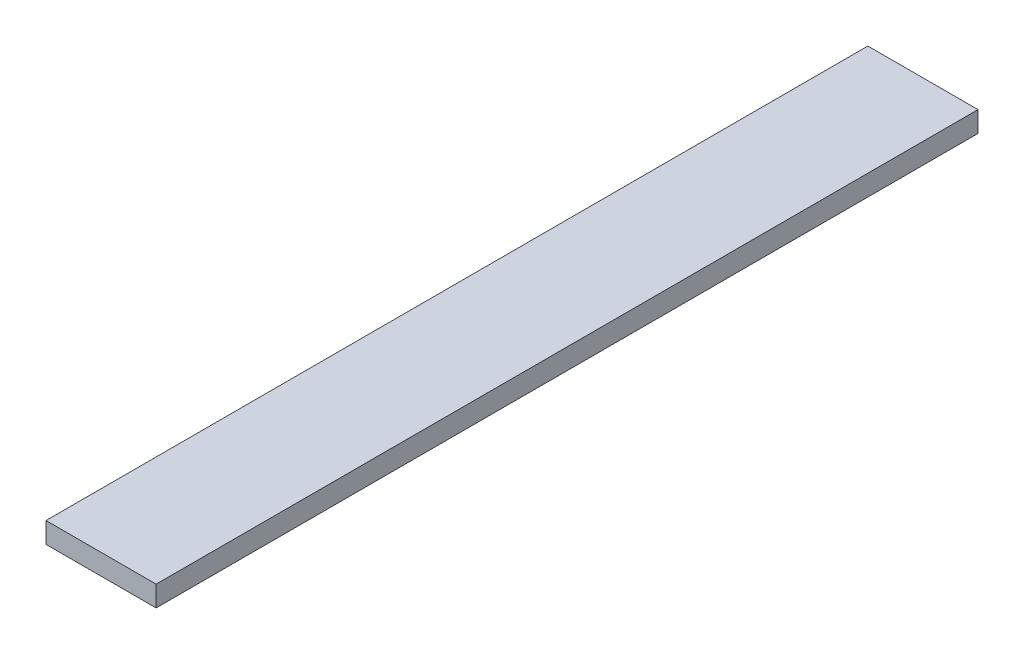
from build123d import *

# Parameters (mm, degrees)
SKETCH1_W           = 101.6
SKETCH1_H           = 758.19
BOSS_EXTRUDE1_DEPTH = 19.05


with BuildPart() as part:
    # Sketch1 → Boss-Extrude1 (new body)
    with BuildSketch(Plane(origin=(0, 0, 0), x_dir=(1, 0, 0), z_dir=(0, 1, 0))):
        with Locations((50.8, -379.095)):
            Rectangle(SKETCH1_W, SKETCH1_H)
    extrude(amount=BOSS_EXTRUDE1_DEPTH)


solid = part.part
